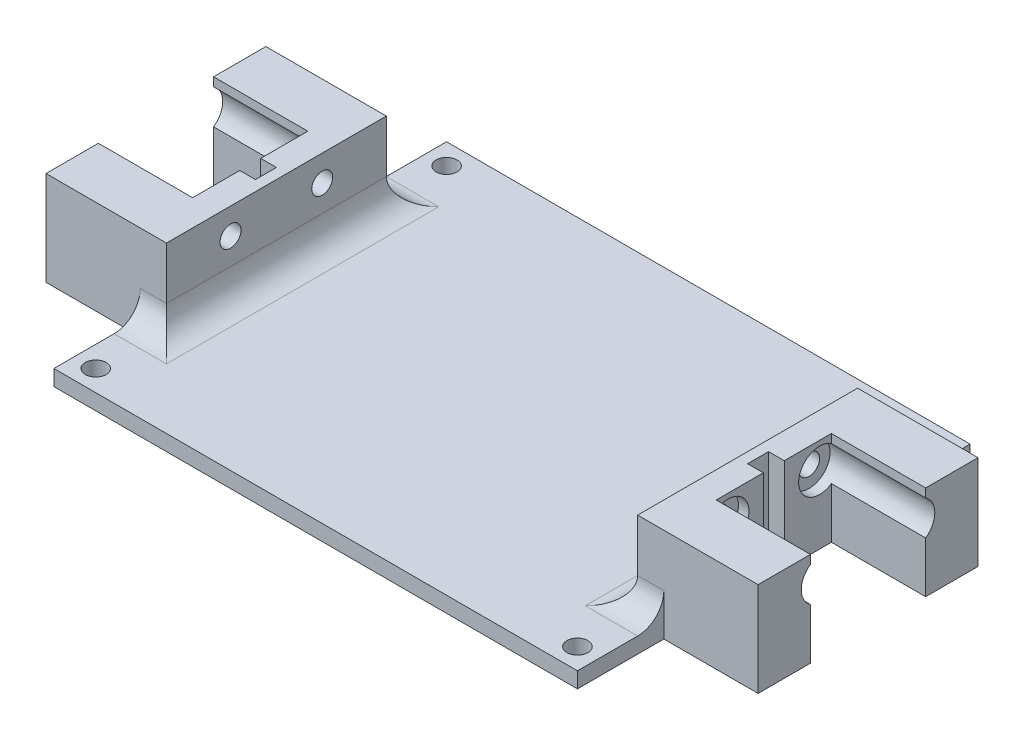
from build123d import *

# Parameters (mm, degrees)
BOSS_EXTRUDE1_DEPTH = 3
BOSS_EXTRUDE2_DEPTH = 15
SKETCH3_R           = 2
CUT_EXTRUDE1_DEPTH  = 126.116945295
SKETCH5_R           = 4
CUT_EXTRUDE3_DEPTH  = 20
CUT_EXTRUDE4_START  = -20
SKETCH6_R           = 4
CUT_EXTRUDE4_DEPTH  = 20
FILLET1_R           = 5
SKETCH7_R           = 2
CUT_EXTRUDE5_DEPTH  = 20


with BuildPart() as part:
    # Sketch1 → Boss-Extrude1 (new body)
    with BuildSketch(Plane(origin=(0, 0, 0), x_dir=(1, 0, 0), z_dir=(0, 1, 0))):
        Polygon((50, 2), (50, 11), (68, 11), (68, 21), (50, 21), (50, 37.5), (-50, 37.5), (-50, 21), (-68, 21), (-68, 11), (-50, 11), (-50, 2), (-47, 2), (-47, -2), (-50, -2), (-50, -11), (-68, -11), (-68, -21), (-50, -21), (-50, -37.5), (50, -37.5), (50, -21), (68, -21), (68, -11), (50, -11), (50, -2), (47, -2), (47, 2), align=None)
    extrude(amount=BOSS_EXTRUDE1_DEPTH)

    # Sketch2 → Boss-Extrude2 (add)
    with BuildSketch(Plane(origin=(0, 3, 0), x_dir=(1, 0, 0), z_dir=(0, 1, 0))):
        Polygon((-68, 11), (-68, 21), (-45, 21), (-45, -21), (-68, -21), (-68, -11), (-50, -11), (-50, -2), (-47, -2), (-47, 2), (-50, 2), (-50, 11), align=None)
        Polygon((45, -21), (45, 21), (68, 21), (68, 11), (50, 11), (50, 2), (47, 2), (47, -2), (50, -2), (50, -11), (68, -11), (68, -21), align=None)
    extrude(amount=BOSS_EXTRUDE2_DEPTH)

    # Sketch3 → Cut-Extrude1 (cut, through all)
    with BuildSketch(Plane.ZY.offset(50)):
        with Locations((-8.75, 13.029436278)):
            Circle(SKETCH3_R)
        with Locations((8.75, 13.029436278)):
            Circle(SKETCH3_R)
    extrude(amount=-CUT_EXTRUDE1_DEPTH, mode=Mode.SUBTRACT)

    # Sketch5 → Cut-Extrude3 (cut)
    with BuildSketch(Plane(origin=(68, 0, 0), x_dir=(0, 0, -1), z_dir=(1, 0, 0))):
        with Locations((-8.75, 13.029436278)):
            Circle(SKETCH5_R)
        with Locations((8.75, 13.029436278)):
            Circle(SKETCH5_R)
    extrude(amount=-CUT_EXTRUDE3_DEPTH, mode=Mode.SUBTRACT)

    # Sketch6 → Cut-Extrude4 (cut)
    with BuildSketch(Plane.ZY.offset(68).offset(CUT_EXTRUDE4_START)):
        with Locations(Location((8.75, 13.029436278, 0), (0, 0, 180))):
            Circle(SKETCH6_R)
        with Locations(Location((-8.75, 13.029436278, 0), (0, 0, 180))):
            Circle(SKETCH6_R)
    extrude(amount=CUT_EXTRUDE4_DEPTH, mode=Mode.SUBTRACT)

    # Fillet1
    fillet1_edges = [part.edges().sort_by_distance(p)[0] for p in [
        (47.5, 3, 21),
        (47.5, 3, -21),
        (45, 3, 0),
        (-47.5, 3, 21),
        (-45, 3, 0),
        (-47.5, 3, -21),
    ]]
    fillet(fillet1_edges, radius=FILLET1_R)

    # Sketch7 → Cut-Extrude5 (cut)
    with BuildSketch(Plane(origin=(0, 3, 0), x_dir=(1, 0, 0), z_dir=(0, 1, 0))):
        with Locations(Location((46, 33.5, 0), (0, 0, 270))):
            Circle(SKETCH7_R)
        with Locations(Location((-46, 33.5, 0), (0, 0, 270))):
            Circle(SKETCH7_R)
        with Locations(Location((46, -33.5, 0), (0, 0, 270))):
            Circle(SKETCH7_R)
        with Locations(Location((-46, -33.5, 0), (0, 0, 270))):
            Circle(SKETCH7_R)
    extrude(amount=-CUT_EXTRUDE5_DEPTH, mode=Mode.SUBTRACT)


solid = part.part
